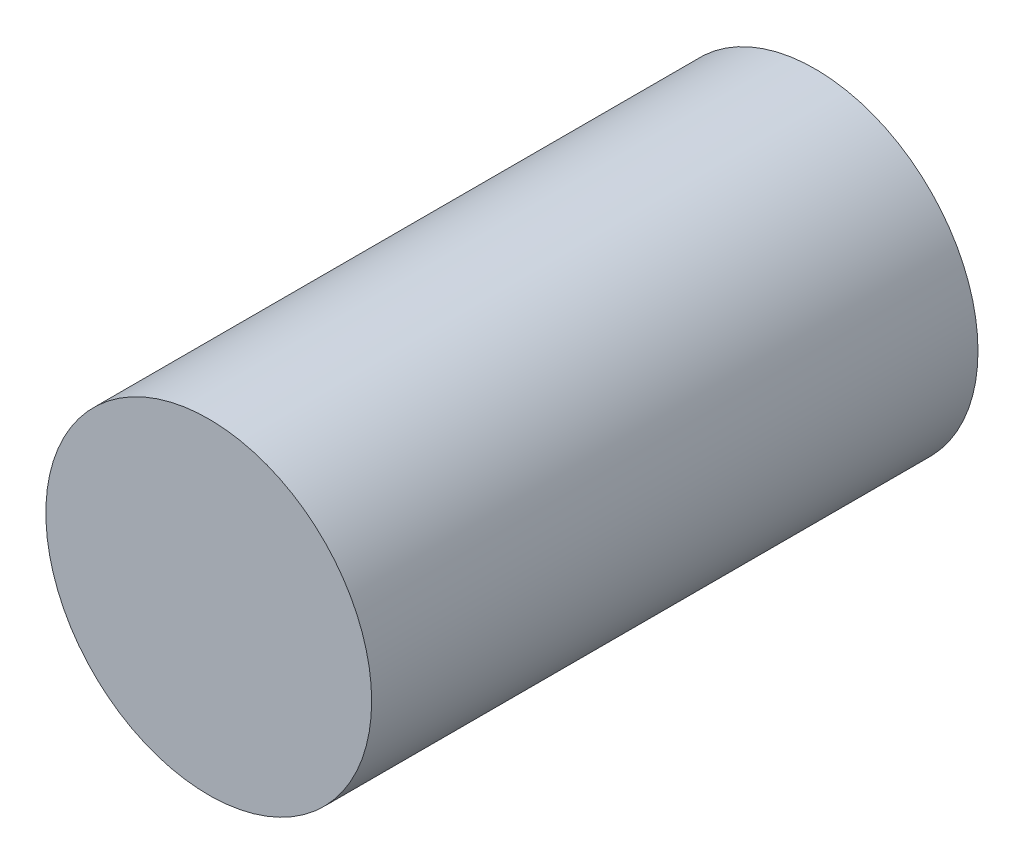
from build123d import *

# Parameters (mm, degrees)
SKETCH1_R           = 18
BOSS_EXTRUDE1_DEPTH = 67


with BuildPart() as part:
    # Sketch1 → Boss-Extrude1 (new body)
    with BuildSketch(Plane.XY):
        Circle(SKETCH1_R)
    extrude(amount=BOSS_EXTRUDE1_DEPTH)


solid = part.part
